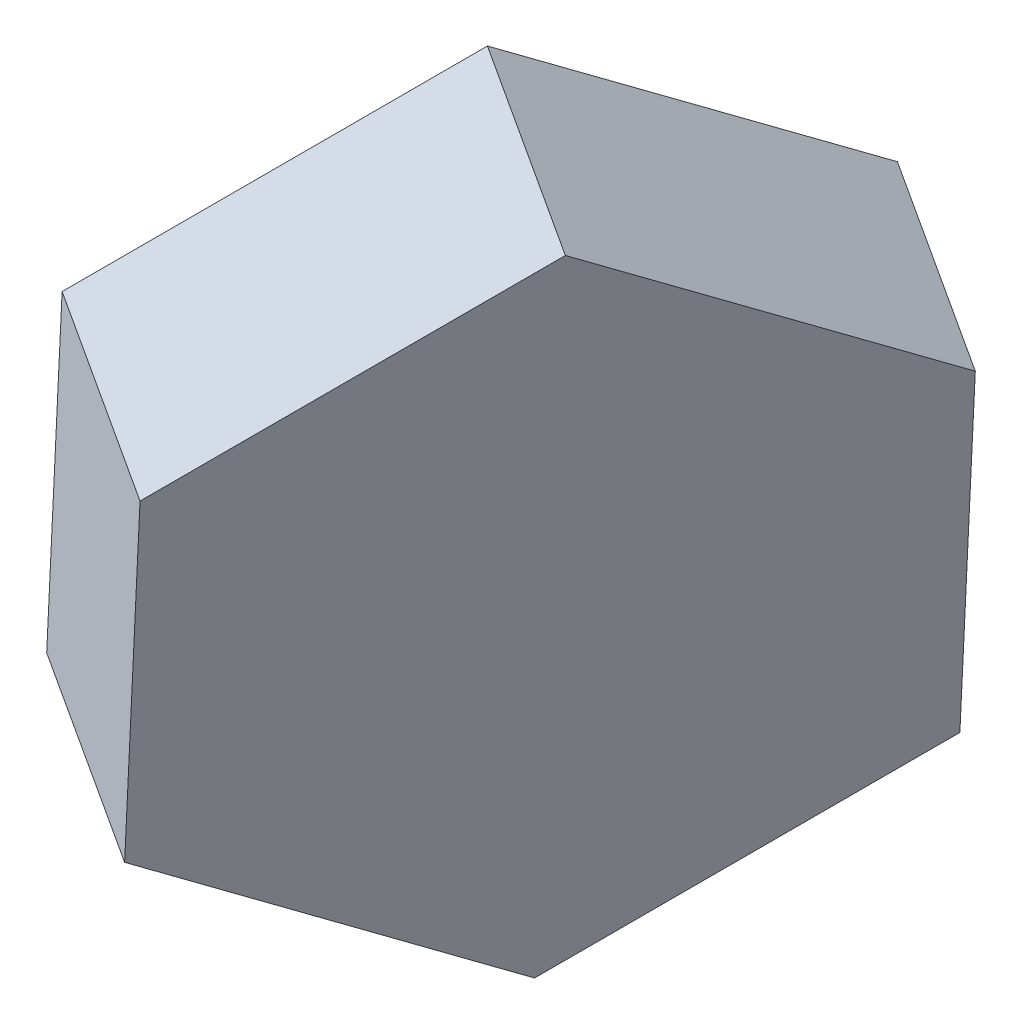
from build123d import *

# Parameters (mm, degrees)
EXTRUDE_1_DEPTH   = 10
MOVE_BODY_1_ANGLE = 64.736825646
SKETCH_2_R        = 4
EXTRUDE_2_DEPTH   = 3


with BuildPart() as part:
    # 草图1 → 凸台-拉伸1 (new body)
    with BuildSketch(Plane.XY):
        Polygon((7.994684102, 13.847199055), (-7.994684102, 13.847199055), (-15.989368203, 0), (-7.994684102, -13.847199055), (7.994684102, -13.847199055), (15.989368203, 0), align=None)
    extrude(amount=EXTRUDE_1_DEPTH)


with BuildPart() as part_1:
    # Move Body 1: moved
    add(part.part.rotate(Axis((-0.638697904, -1.541953143, 4.361302096), (0.3574067443365927, 0.8628562094610174, 0.3574067443365927)), MOVE_BODY_1_ANGLE))

    # 草图2 → 凸台-拉伸2 (add)
    with BuildSketch(Plane(origin=(-2.133883476, 0.366116524, -1.25), x_dir=(-0.49279927982674293, 0.08455098936288066, 0.8660254037844396), z_dir=(-0.8535533905932747, 0.14644660940672574, -0.49999999999999845))):
        with Locations(Location((4.330127019, 0, 0), (0, 0, 175.096803722))):
            Circle(SKETCH_2_R)
    extrude(amount=EXTRUDE_2_DEPTH)


solid = part_1.part
